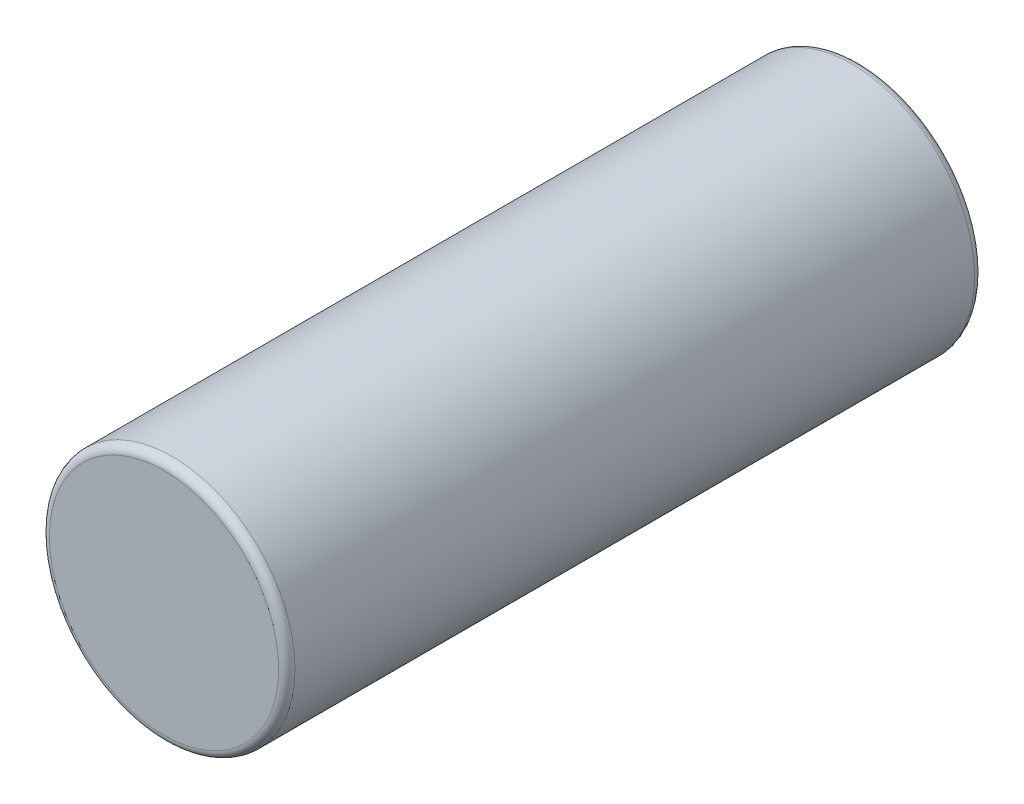
from build123d import *

# Parameters (mm, degrees)
ESQUISSE1_R      = 1.5
EXTRUSION1_DEPTH = 8.5
CONG_1_R         = 0.1


with BuildPart() as part:
    # Esquisse1 → Extrusion1 (new body)
    with BuildSketch(Plane.XY):
        Circle(ESQUISSE1_R)
    extrude(amount=EXTRUSION1_DEPTH)

    # Congé1
    cong_1_edges = [part.edges().sort_by_distance(p)[0] for p in [
        (-1.5, 0, 0),
        (-1.5, 0, 8.5),
    ]]
    fillet(cong_1_edges, radius=CONG_1_R)


solid = part.part
